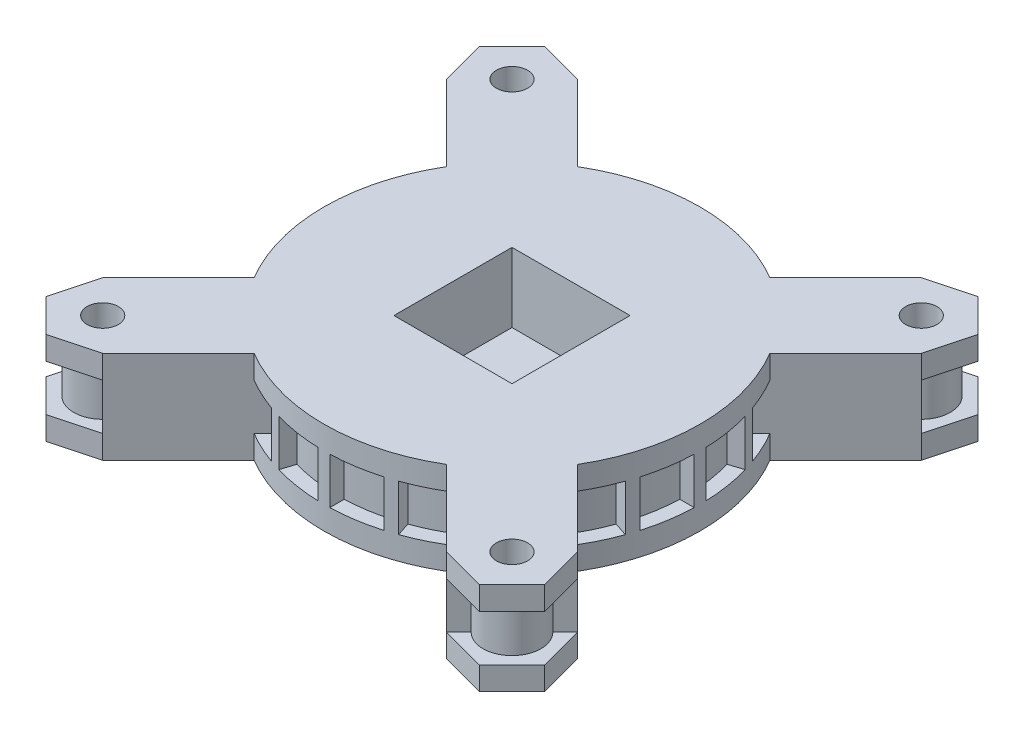
from build123d import *

# Parameters (mm, degrees)
BOSS_EXTRUDE8_DEPTH  = 4
BOSS_EXTRUDE10_DEPTH = 8
BOSS_EXTRUDE11_DEPTH = 4
SKETCH14_R           = 2.7
SKETCH14_W           = 20.4
SKETCH14_H           = 20.4
CUT_EXTRUDE1_DEPTH   = 12


with BuildPart() as part:
    # Sketch11 → Boss-Extrude8 (new body)
    with BuildSketch(Plane(origin=(0, 0, 0), x_dir=(1, 0, 0), z_dir=(0, 1, 0))):
        with BuildLine():
            Line((27.930717857, -16.617009358), (41.012193309, -29.69848481))
            Line((41.012193309, -29.69848481), (43.08274567, -37.42589142))
            Line((43.08274567, -37.42589142), (37.42589142, -43.08274567))
            Line((37.42589142, -43.08274567), (29.69848481, -41.012193309))
            Line((29.69848481, -41.012193309), (16.617009358, -27.930717857))
            ThreePointArc((16.617009358, -27.930717857), (0, -32.5), (-16.617009358, -27.930717857))
            Line((-16.617009358, -27.930717857), (-29.69848481, -41.012193309))
            Line((-29.69848481, -41.012193309), (-37.42589142, -43.08274567))
            Line((-37.42589142, -43.08274567), (-43.08274567, -37.42589142))
            Line((-43.08274567, -37.42589142), (-41.012193309, -29.69848481))
            Line((-41.012193309, -29.69848481), (-27.930717857, -16.617009358))
            ThreePointArc((-27.930717857, -16.617009358), (-32.5, 0), (-27.930717857, 16.617009358))
            Line((-27.930717857, 16.617009358), (-41.012193309, 29.69848481))
            Line((-41.012193309, 29.69848481), (-43.08274567, 37.42589142))
            Line((-43.08274567, 37.42589142), (-37.42589142, 43.08274567))
            Line((-37.42589142, 43.08274567), (-29.69848481, 41.012193309))
            Line((-29.69848481, 41.012193309), (-16.617009358, 27.930717857))
            ThreePointArc((-16.617009358, 27.930717857), (0, 32.5), (16.617009358, 27.930717857))
            Line((16.617009358, 27.930717857), (29.69848481, 41.012193309))
            Line((29.69848481, 41.012193309), (37.42589142, 43.08274567))
            Line((37.42589142, 43.08274567), (43.08274567, 37.42589142))
            Line((43.08274567, 37.42589142), (41.012193309, 29.69848481))
            Line((41.012193309, 29.69848481), (27.930717857, 16.617009358))
            ThreePointArc((27.930717857, 16.617009358), (32.5, 0), (27.930717857, -16.617009358))
        make_face()
    extrude(amount=BOSS_EXTRUDE8_DEPTH)

    # Sketch12 → Boss-Extrude10 (add)
    with BuildSketch(Plane(origin=(0, 4, 0), x_dir=(1, 0, 0), z_dir=(0, 1, 0))):
        with BuildLine():
            Line((38.890872967, 31.819805152), (41.012193309, 29.69848481))
            Line((41.012193309, 29.69848481), (26.10190255, 14.788194051))
            ThreePointArc((26.10190255, 14.788194051), (27.250407583, 12.546524879), (28.206823147, 10.216414633))
            Line((28.206823147, 10.216414633), (30.585684682, 10.9893536))
            ThreePointArc((30.585684682, 10.9893536), (30.90933678, 10.043052317), (31.203718671, 9.087240568))
            Line((31.203718671, 9.087240568), (28.824857136, 8.3143016))
            ThreePointArc((28.824857136, 8.3143016), (29.630650218, 4.693033951), (29.983328701, 1))
            Line((29.983328701, 1), (32.484611742, 1))
            ThreePointArc((32.484611742, 1), (32.5, 0), (32.484611742, -1))
            Line((32.484611742, -1), (29.983328701, -1))
            ThreePointArc((29.983328701, -1), (29.630650218, -4.693033951), (28.824857136, -8.3143016))
            Line((28.824857136, -8.3143016), (31.203718671, -9.087240568))
            ThreePointArc((31.203718671, -9.087240568), (30.90933678, -10.043052317), (30.585684682, -10.9893536))
            Line((30.585684682, -10.9893536), (28.206823147, -10.216414633))
            ThreePointArc((28.206823147, -10.216414633), (27.250407583, -12.546524879), (26.10190255, -14.788194051))
            Line((26.10190255, -14.788194051), (41.012193309, -29.69848481))
            Line((41.012193309, -29.69848481), (38.890872965, -31.819805153))
            ThreePointArc((38.890872965, -31.819805153), (38.890872965, -38.890872967), (31.819805152, -38.890872967))
            Line((31.819805152, -38.890872967), (29.69848481, -41.012193309))
            Line((29.69848481, -41.012193309), (14.788194051, -26.10190255))
            ThreePointArc((14.788194051, -26.10190255), (12.546524879, -27.250407583), (10.216414633, -28.206823147))
            Line((10.216414633, -28.206823147), (10.9893536, -30.585684682))
            ThreePointArc((10.9893536, -30.585684682), (10.043052317, -30.90933678), (9.087240568, -31.203718671))
            Line((9.087240568, -31.203718671), (8.3143016, -28.824857136))
            ThreePointArc((8.3143016, -28.824857136), (4.693033951, -29.630650218), (1, -29.983328701))
            Line((1, -29.983328701), (1, -32.484611742))
            ThreePointArc((1, -32.484611742), (0, -32.5), (-1, -32.484611742))
            Line((-1, -32.484611742), (-1, -29.983328701))
            ThreePointArc((-1, -29.983328701), (-4.693033951, -29.630650218), (-8.3143016, -28.824857136))
            Line((-8.3143016, -28.824857136), (-9.087240568, -31.203718671))
            ThreePointArc((-9.087240568, -31.203718671), (-10.043052317, -30.90933678), (-10.9893536, -30.585684682))
            Line((-10.9893536, -30.585684682), (-10.216414633, -28.206823147))
            ThreePointArc((-10.216414633, -28.206823147), (-12.546524879, -27.250407583), (-14.788194051, -26.10190255))
            Line((-14.788194051, -26.10190255), (-29.69848481, -41.012193309))
            Line((-29.69848481, -41.012193309), (-31.819805153, -38.890872965))
            ThreePointArc((-31.819805153, -38.890872965), (-38.890872967, -38.890872965), (-38.890872967, -31.819805152))
            Line((-38.890872967, -31.819805152), (-41.012193309, -29.69848481))
            Line((-41.012193309, -29.69848481), (-26.10190255, -14.788194051))
            ThreePointArc((-26.10190255, -14.788194051), (-27.250407583, -12.546524879), (-28.206823147, -10.216414633))
            Line((-28.206823147, -10.216414633), (-30.585684682, -10.9893536))
            ThreePointArc((-30.585684682, -10.9893536), (-30.90933678, -10.043052317), (-31.203718671, -9.087240568))
            Line((-31.203718671, -9.087240568), (-28.824857136, -8.3143016))
            ThreePointArc((-28.824857136, -8.3143016), (-29.630650218, -4.693033951), (-29.983328701, -1))
            Line((-29.983328701, -1), (-32.484611742, -1))
            ThreePointArc((-32.484611742, -1), (-32.5, 0), (-32.484611742, 1))
            Line((-32.484611742, 1), (-29.983328701, 1))
            ThreePointArc((-29.983328701, 1), (-29.630650218, 4.693033951), (-28.824857136, 8.3143016))
            Line((-28.824857136, 8.3143016), (-31.203718671, 9.087240568))
            ThreePointArc((-31.203718671, 9.087240568), (-30.90933678, 10.043052317), (-30.585684682, 10.9893536))
            Line((-30.585684682, 10.9893536), (-28.206823147, 10.216414633))
            ThreePointArc((-28.206823147, 10.216414633), (-27.250407583, 12.546524879), (-26.10190255, 14.788194051))
            Line((-26.10190255, 14.788194051), (-41.012193309, 29.69848481))
            Line((-41.012193309, 29.69848481), (-38.890872965, 31.819805153))
            ThreePointArc((-38.890872965, 31.819805153), (-38.890872965, 38.890872967), (-31.819805152, 38.890872967))
            Line((-31.819805152, 38.890872967), (-29.69848481, 41.012193309))
            Line((-29.69848481, 41.012193309), (-14.788194051, 26.10190255))
            ThreePointArc((-14.788194051, 26.10190255), (-12.546524879, 27.250407583), (-10.216414633, 28.206823147))
            Line((-10.216414633, 28.206823147), (-10.9893536, 30.585684682))
            ThreePointArc((-10.9893536, 30.585684682), (-10.043052317, 30.90933678), (-9.087240568, 31.203718671))
            Line((-9.087240568, 31.203718671), (-8.3143016, 28.824857136))
            ThreePointArc((-8.3143016, 28.824857136), (-4.693033951, 29.630650218), (-1, 29.983328701))
            Line((-1, 29.983328701), (-1, 32.484611742))
            ThreePointArc((-1, 32.484611742), (0, 32.5), (1, 32.484611742))
            Line((1, 32.484611742), (1, 29.983328701))
            ThreePointArc((1, 29.983328701), (4.693033951, 29.630650218), (8.3143016, 28.824857136))
            Line((8.3143016, 28.824857136), (9.087240568, 31.203718671))
            ThreePointArc((9.087240568, 31.203718671), (10.043052317, 30.90933678), (10.9893536, 30.585684682))
            Line((10.9893536, 30.585684682), (10.216414633, 28.206823147))
            ThreePointArc((10.216414633, 28.206823147), (12.546524879, 27.250407583), (14.788194051, 26.10190255))
            Line((14.788194051, 26.10190255), (29.69848481, 41.012193309))
            Line((29.69848481, 41.012193309), (31.819805153, 38.890872965))
            ThreePointArc((31.819805153, 38.890872965), (38.890872967, 38.890872965), (38.890872967, 31.819805152))
        make_face()
    extrude(amount=BOSS_EXTRUDE10_DEPTH)

    # Sketch13 → Boss-Extrude11 (add)
    with BuildSketch(Plane(origin=(0, 12, 0), x_dir=(1, 0, 0), z_dir=(0, 1, 0))):
        with BuildLine():
            Line((27.930717857, -16.617009358), (41.012193309, -29.69848481))
            Line((41.012193309, -29.69848481), (43.08274567, -37.42589142))
            Line((43.08274567, -37.42589142), (37.42589142, -43.08274567))
            Line((37.42589142, -43.08274567), (29.69848481, -41.012193309))
            Line((29.69848481, -41.012193309), (16.617009358, -27.930717857))
            ThreePointArc((16.617009358, -27.930717857), (0, -32.5), (-16.617009358, -27.930717857))
            Line((-16.617009358, -27.930717857), (-29.69848481, -41.012193309))
            Line((-29.69848481, -41.012193309), (-37.42589142, -43.08274567))
            Line((-37.42589142, -43.08274567), (-43.08274567, -37.42589142))
            Line((-43.08274567, -37.42589142), (-41.012193309, -29.69848481))
            Line((-41.012193309, -29.69848481), (-27.930717857, -16.617009358))
            ThreePointArc((-27.930717857, -16.617009358), (-32.5, 0), (-27.930717857, 16.617009358))
            Line((-27.930717857, 16.617009358), (-41.012193309, 29.69848481))
            Line((-41.012193309, 29.69848481), (-43.08274567, 37.42589142))
            Line((-43.08274567, 37.42589142), (-37.42589142, 43.08274567))
            Line((-37.42589142, 43.08274567), (-29.69848481, 41.012193309))
            Line((-29.69848481, 41.012193309), (-16.617009358, 27.930717857))
            ThreePointArc((-16.617009358, 27.930717857), (0, 32.5), (16.617009358, 27.930717857))
            Line((16.617009358, 27.930717857), (29.69848481, 41.012193309))
            Line((29.69848481, 41.012193309), (37.42589142, 43.08274567))
            Line((37.42589142, 43.08274567), (43.08274567, 37.42589142))
            Line((43.08274567, 37.42589142), (41.012193309, 29.69848481))
            Line((41.012193309, 29.69848481), (27.930717857, 16.617009358))
            ThreePointArc((27.930717857, 16.617009358), (32.5, 0), (27.930717857, -16.617009358))
        make_face()
    extrude(amount=BOSS_EXTRUDE11_DEPTH)

    # Sketch14 → Cut-Extrude1 (cut)
    with BuildSketch(Plane(origin=(0, 16, 0), x_dir=(1, 0, 0), z_dir=(0, 1, 0))):
        with Locations(Location((-35.355339059, 35.355339059, 0), (0, 0, 270))):
            Circle(SKETCH14_R)
        with Locations(Location((35.355339059, 35.355339059, 0), (0, 0, 270))):
            Circle(SKETCH14_R)
        with Locations(Location((35.355339059, -35.355339059, 0), (0, 0, 270))):
            Circle(SKETCH14_R)
        with Locations(Location((-35.355339059, -35.355339059, 0), (0, 0, 270))):
            Circle(SKETCH14_R)
        Rectangle(SKETCH14_W, SKETCH14_H)
    extrude(amount=-CUT_EXTRUDE1_DEPTH, mode=Mode.SUBTRACT)


solid = part.part
